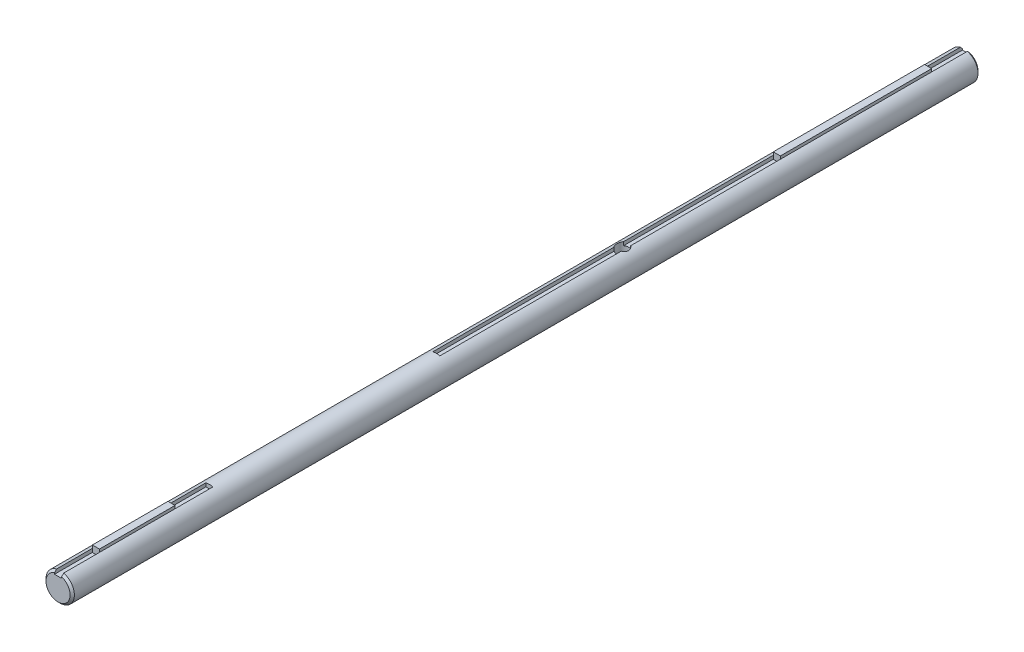
from build123d import *

# Parameters (mm, degrees)
SKETCH3_R               = 9.525
BOSS_EXTRUDE1_DEPTH     = 304.8
CHAMFER1_SIZE           = 1.42875
CUT_EXTRUDE1_START      = -101.6
CUT_EXTRUDE1_DEPTH      = 101.600004
CUT_EXTRUDE2_DEPTH      = 355.6
BOSS_EXTRUDE2_DEPTH     = 50.8
BOSS_EXTRUDE3_DEPTH     = 101.6
CUT_EXTRUDE3_DEPTH      = 306.153633722
CUT_EXTRUDE3_DEPTH_BACK = 306.153633722
SKETCH9_R               = 3.96875


with BuildPart() as part:
    # Sketch3 → Boss-Extrude1 (new, symmetric)
    with BuildSketch(Plane.XY):
        with Locations(Location((0, 0, 0), (0, 0, 180))):
            Circle(SKETCH3_R)
    extrude(amount=BOSS_EXTRUDE1_DEPTH, both=True)

    # Chamfer1
    chamfer1_edges = [part.edges().sort_by_distance(p)[0] for p in [
        (9.525, 0, -304.8),
        (9.525, 0, 304.8),
    ]]
    chamfer(chamfer1_edges, length=CHAMFER1_SIZE)

    # Sketch5 → Cut-Extrude1 (cut)
    with BuildSketch(Plane.XY.offset(304.8).offset(CUT_EXTRUDE1_START)):
        Polygon((-2.38125, 11.179201601), (2.38125, 11.179201601), (2.38125, 9.222541593), (2.38125, 6.841291593), (-2.38125, 6.841291593), (-2.38125, 9.222541593), align=None)
    extrude(amount=CUT_EXTRUDE1_DEPTH, mode=Mode.SUBTRACT)

    # Sketch6 → Cut-Extrude2 (cut)
    with BuildSketch(Plane(origin=(0, 0, -304.8), x_dir=(-1, 0, 0), z_dir=(0, 0, -1))):
        Polygon((2.38125, 11.179201601), (-2.38125, 11.179201601), (-2.38125, 9.222541593), (-2.38125, 6.841291593), (2.38125, 6.841291593), (2.38125, 9.222541593), align=None)
    extrude(amount=-CUT_EXTRUDE2_DEPTH, mode=Mode.SUBTRACT)

    # Sketch7 → Boss-Extrude2 (add)
    with BuildSketch(Plane.XY.offset(279.4)):
        Polygon((-2.38125, 11.179201601), (-2.38125, 9.222541593), (-2.38125, 6.841291593), (2.38125, 6.841291593), (2.38125, 9.222541593), (2.38125, 11.179201601), align=None)
    extrude(amount=-BOSS_EXTRUDE2_DEPTH)

    # Sketch8 → Boss-Extrude3 (add)
    with BuildSketch(Plane.XY.offset(-279.4)):
        Polygon((-2.38125, 11.179201601), (-2.38125, 9.222541593), (-2.38125, 6.841291593), (2.38125, 6.841291593), (2.38125, 9.222541593), (2.38125, 11.179201601), align=None)
    extrude(amount=BOSS_EXTRUDE3_DEPTH)

    # Sketch9 → Cut-Extrude3 (cut, two sides: drawn at the far end of the back side and taken through both)
    with BuildSketch(Plane(origin=(0, 0, 0), x_dir=(1, 0, 0), z_dir=(0, 1, 0)).offset(-CUT_EXTRUDE3_DEPTH_BACK)):
        with Locations(Location((0, 74.168, 0), (0, 0, 270))):
            Circle(SKETCH9_R)
    extrude(amount=CUT_EXTRUDE3_DEPTH + CUT_EXTRUDE3_DEPTH_BACK, mode=Mode.SUBTRACT)


solid = part.part
